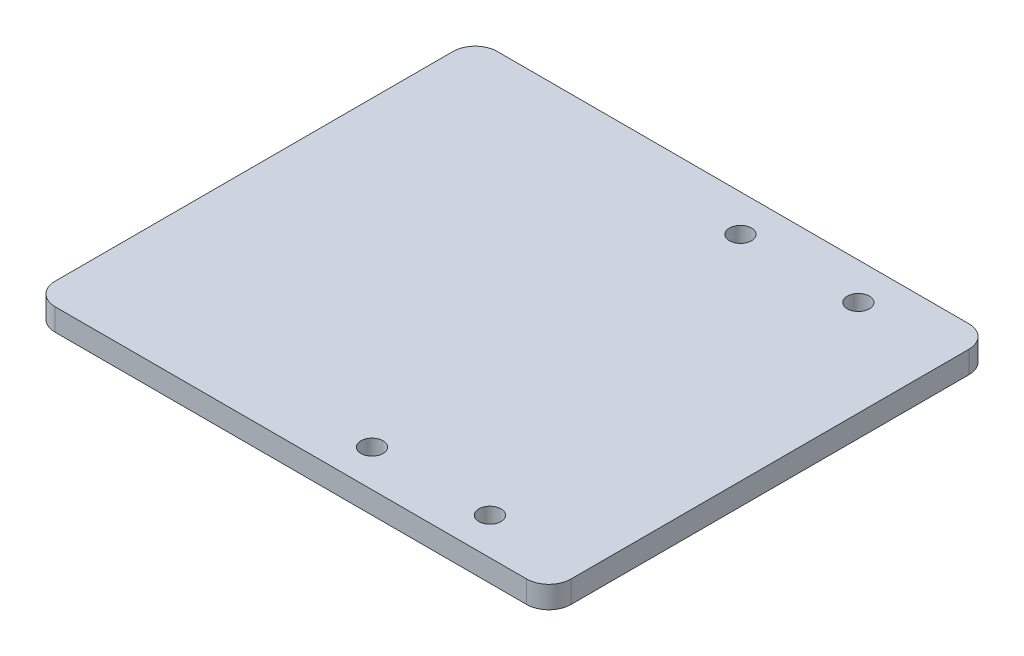
from build123d import *

# Parameters (mm, degrees)
SKETCH_1_W          = 70
SKETCH_1_H          = 60
EXTRUDE_1_DEPTH     = 3
SKETCH_2_R          = 1.5
CUT_EXTRUDE_1_DEPTH = 93.244241013
FILLET_1_R          = 3


with BuildPart() as part:
    # 草图1 → 凸台-拉伸1 (new body)
    with BuildSketch(Plane(origin=(0, 0, 0), x_dir=(1, 0, 0), z_dir=(0, 1, 0))):
        with Locations((35, -30)):
            Rectangle(SKETCH_1_W, SKETCH_1_H)
    extrude(amount=EXTRUDE_1_DEPTH)

    # 草图2 → 切除-拉伸1 (cut, through all)
    with BuildSketch(Plane(origin=(0, 3, 0), x_dir=(1, 0, 0), z_dir=(0, 1, 0))):
        with Locations(Location((57, -5, 0), (0, 0, 270))):
            Circle(SKETCH_2_R)
        with Locations(Location((41, -5, 0), (0, 0, 270))):
            Circle(SKETCH_2_R)
        with Locations(Location((57, -55, 0), (0, 0, 270))):
            Circle(SKETCH_2_R)
        with Locations(Location((41, -55, 0), (0, 0, 270))):
            Circle(SKETCH_2_R)
    extrude(amount=-CUT_EXTRUDE_1_DEPTH, mode=Mode.SUBTRACT)

    # 圆角1
    fillet_1_edges = [part.edges().sort_by_distance(p)[0] for p in [
        (0, 1.5, 0),
        (70, 1.5, 0),
        (70, 1.5, 60),
        (0, 1.5, 60),
    ]]
    fillet(fillet_1_edges, radius=FILLET_1_R)


solid = part.part
